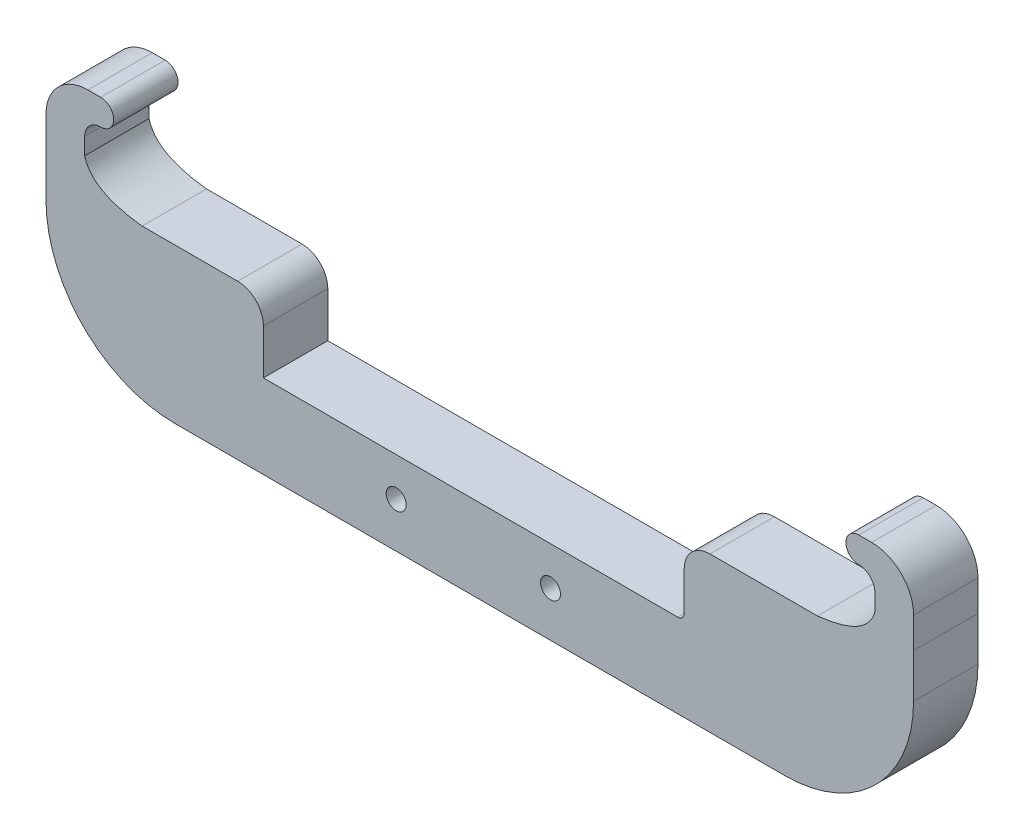
from build123d import *

# Parameters (mm, degrees)
DODANIE_WYCI_GNI_CIE1_DEPTH = 10
SZKIC2_R                    = 1.55
WYTNIJ_WYCI_GNI_CIE1_DEPTH  = 10


with BuildPart() as part:
    # Szkic1 → Dodanie-wyciągnięcie1 (new body)
    with BuildSketch(Plane.XY):
        with BuildLine():
            Line((650.135201584, -439.296174139), (667.497764869, -439.296174139))
            ThreePointArc((667.497764869, -439.296174139), (681.639900492, -433.438309763), (687.497764869, -419.296174139))
            Line((687.497764869, -419.296174139), (687.49242436, -412.499258381))
            Line((687.49242436, -412.499258381), (687.49242436, -407.696233576))
            ThreePointArc((687.49242436, -407.696233576), (685.588618438, -403.100039498), (680.99242436, -401.196233576))
            Line((680.99242436, -401.196233576), (678.99242436, -401.196233576))
            ThreePointArc((678.99242436, -401.196233576), (676.99242436, -403.196233576), (678.99242436, -405.196233576))
            ThreePointArc((678.99242436, -405.196233576), (680.760191313, -405.928466623), (681.49242436, -407.696233576))
            Line((681.49242436, -407.696233576), (681.49242436, -410.309613134))
            add(Edge.make_bspline(
                [(672.570535689, -415.296173961), (680.339252513, -414.463379514), (681.49242436, -410.309613134)],
                knots=[0, 0, 0, 0.645201515, 0.645201515, 0.645201515], degree=2))
            Line((672.570535689, -415.296173961), (655.885201584, -415.296173961))
            ThreePointArc((655.885201584, -415.296173961), (653.056774459, -416.467746836), (651.885201584, -419.296173961))
            Line((651.885201584, -419.296173961), (651.885201584, -425.296174139))
            ThreePointArc((651.885201584, -425.296174139), (651.592308365, -426.00328092), (650.885201584, -426.296174139))
            Line((650.885201584, -426.296174139), (647.885201584, -426.296174139))
            Line((647.885201584, -426.296174139), (586.55506807, -426.296174139))
            Line((586.55506807, -426.296174139), (586.55506807, -419.296173961))
            ThreePointArc((586.55506807, -419.296173961), (585.383495195, -416.467746836), (582.55506807, -415.296173961))
            Line((582.55506807, -415.296173961), (567.724994048, -415.296173961))
            add(Edge.make_bspline(
                [(567.724994048, -415.296173961), (559.956277225, -414.463379514), (558.803105378, -410.309613134)],
                knots=[0, 0, 0, 0.645201515, 0.645201515, 0.645201515], degree=2))
            Line((558.803105378, -410.309613134), (558.803105378, -407.696233576))
            ThreePointArc((558.803105378, -407.696233576), (559.535338425, -405.928466623), (561.303105378, -405.196233576))
            ThreePointArc((561.303105378, -405.196233576), (563.303105378, -403.196233576), (561.303105378, -401.196233576))
            Line((561.303105378, -401.196233576), (559.303105378, -401.196233576))
            ThreePointArc((559.303105378, -401.196233576), (554.7069113, -403.100039498), (552.803105378, -407.696233576))
            Line((552.803105378, -407.696233576), (552.803105378, -412.499258381))
            Line((552.803105378, -412.499258381), (552.803105378, -419.296174139))
            ThreePointArc((552.803105378, -419.296174139), (558.660969754, -433.438309763), (572.803105378, -439.296174139))
            Line((572.803105378, -439.296174139), (588.30506807, -439.296174139))
            Line((588.30506807, -439.296174139), (650.135201584, -439.296174139))
        make_face()
    extrude(amount=DODANIE_WYCI_GNI_CIE1_DEPTH)

    # Szkic2 → Wytnij-wyciągnięcie1 (cut)
    with BuildSketch(Plane.XY.offset(10)):
        with Locations((631.130089997, -432.296174368)):
            Circle(SZKIC2_R)
        with Locations((607.164083377, -432.296174368)):
            Circle(SZKIC2_R)
    extrude(amount=-WYTNIJ_WYCI_GNI_CIE1_DEPTH, mode=Mode.SUBTRACT)


solid = part.part
